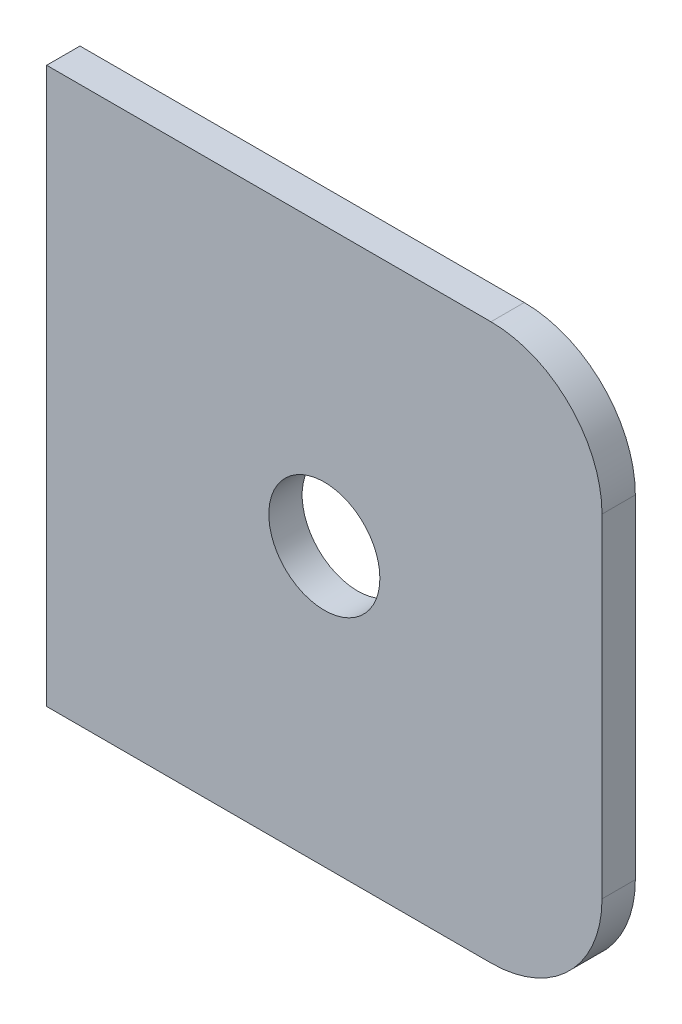
from build123d import *

# Parameters (mm, degrees)
SKETCH1_R           = 5
BOSS_EXTRUDE1_DEPTH = 3


with BuildPart() as part:
    # Sketch1 → Boss-Extrude1 (new body)
    with BuildSketch(Plane.XY):
        with BuildLine():
            Line((-24.011627907, 26.308139535), (15.988372093, 26.308139535))
            ThreePointArc((15.988372093, 26.308139535), (23.059439905, 23.379207347), (25.988372093, 16.308139535))
            Line((25.988372093, 16.308139535), (25.988372093, -13.691860465))
            ThreePointArc((25.988372093, -13.691860465), (23.059439905, -20.762928277), (15.988372093, -23.691860465))
            Line((15.988372093, -23.691860465), (-24.011627907, -23.691860465))
            Line((-24.011627907, -23.691860465), (-24.011627907, 26.308139535))
        make_face()
        with Locations((0.988372093, 1.308139535)):
            Circle(SKETCH1_R, mode=Mode.SUBTRACT)
    extrude(amount=BOSS_EXTRUDE1_DEPTH)


solid = part.part
